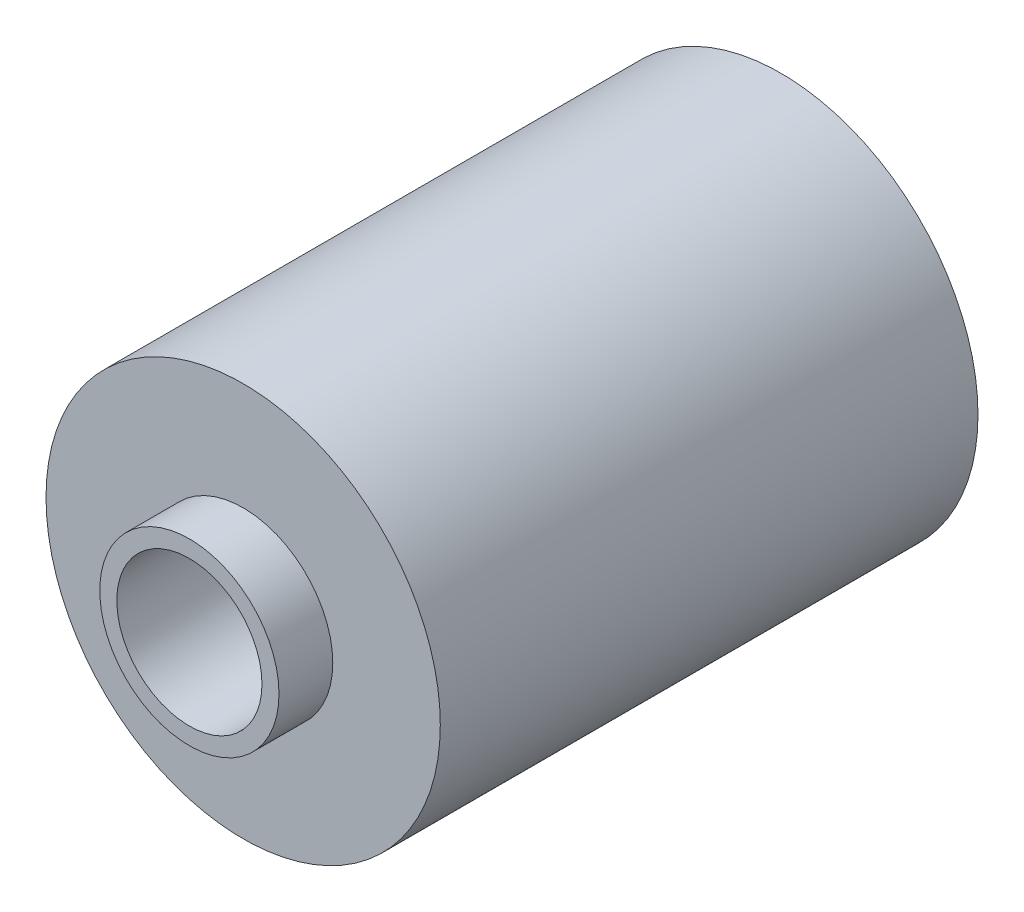
from build123d import *

# Parameters (mm, degrees)
CROQUIS1_R              = 11
SALIENTE_EXTRUIR1_DEPTH = 15
CROQUIS3_R              = 5
SALIENTE_EXTRUIR2_DEPTH = 3
CROQUIS2_R              = 4.05
CORTAR_EXTRUIR1_DEPTH   = 289


with BuildPart() as part:
    # Croquis1 → Saliente-Extruir1 (new, symmetric)
    with BuildSketch(Plane.XY):
        Circle(CROQUIS1_R)
    extrude(amount=SALIENTE_EXTRUIR1_DEPTH, both=True)

    # Croquis3 → Saliente-Extruir2 (add)
    with BuildSketch(Plane.XY.offset(15)):
        Circle(CROQUIS3_R)
    extrude(amount=SALIENTE_EXTRUIR2_DEPTH)

    # Croquis2 → Cortar-Extruir1 (cut, symmetric)
    with BuildSketch(Plane.XY.offset(15)):
        Circle(CROQUIS2_R)
    extrude(amount=CORTAR_EXTRUIR1_DEPTH, both=True, mode=Mode.SUBTRACT)


solid = part.part
